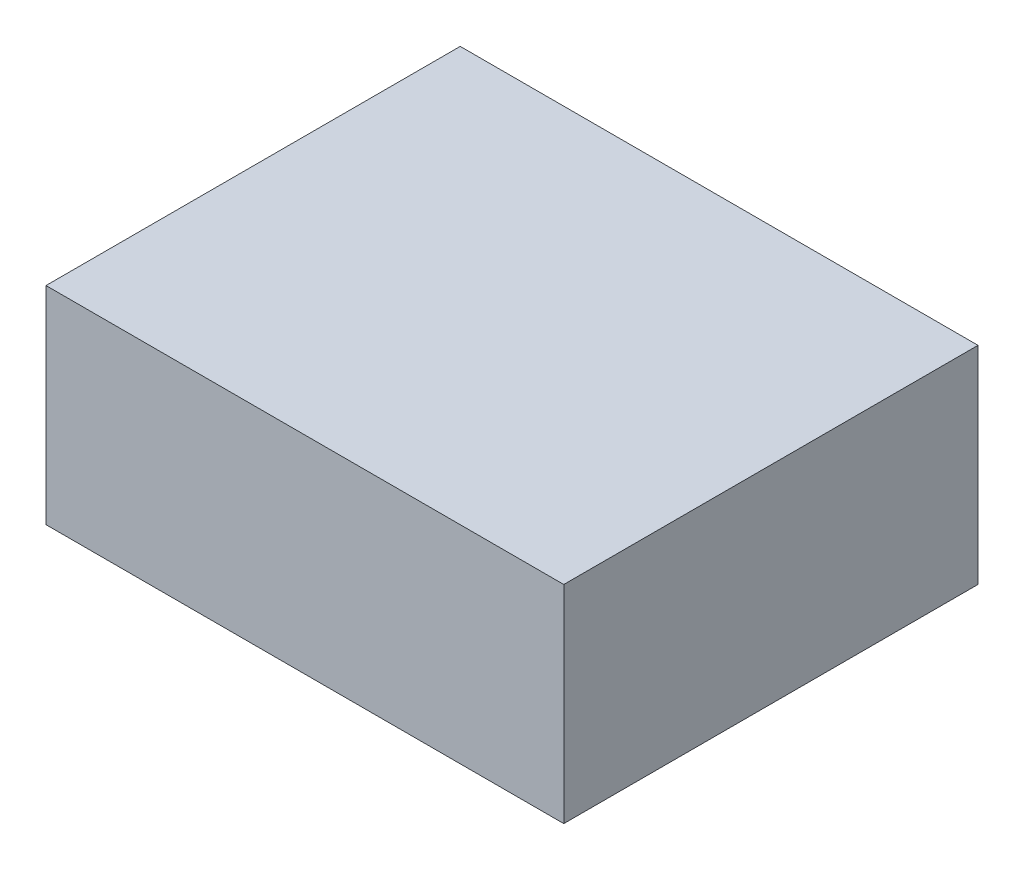
from build123d import *

# Parameters (mm, degrees)
ESQUISSE1_W        = 50
ESQUISSE1_H        = 20
BOSS_EXTRU_1_DEPTH = 40


with BuildPart() as part:
    # Esquisse1 → Boss.-Extru.1 (new body)
    with BuildSketch(Plane.XY):
        with Locations((25, 10)):
            Rectangle(ESQUISSE1_W, ESQUISSE1_H)
    extrude(amount=BOSS_EXTRU_1_DEPTH)


solid = part.part
